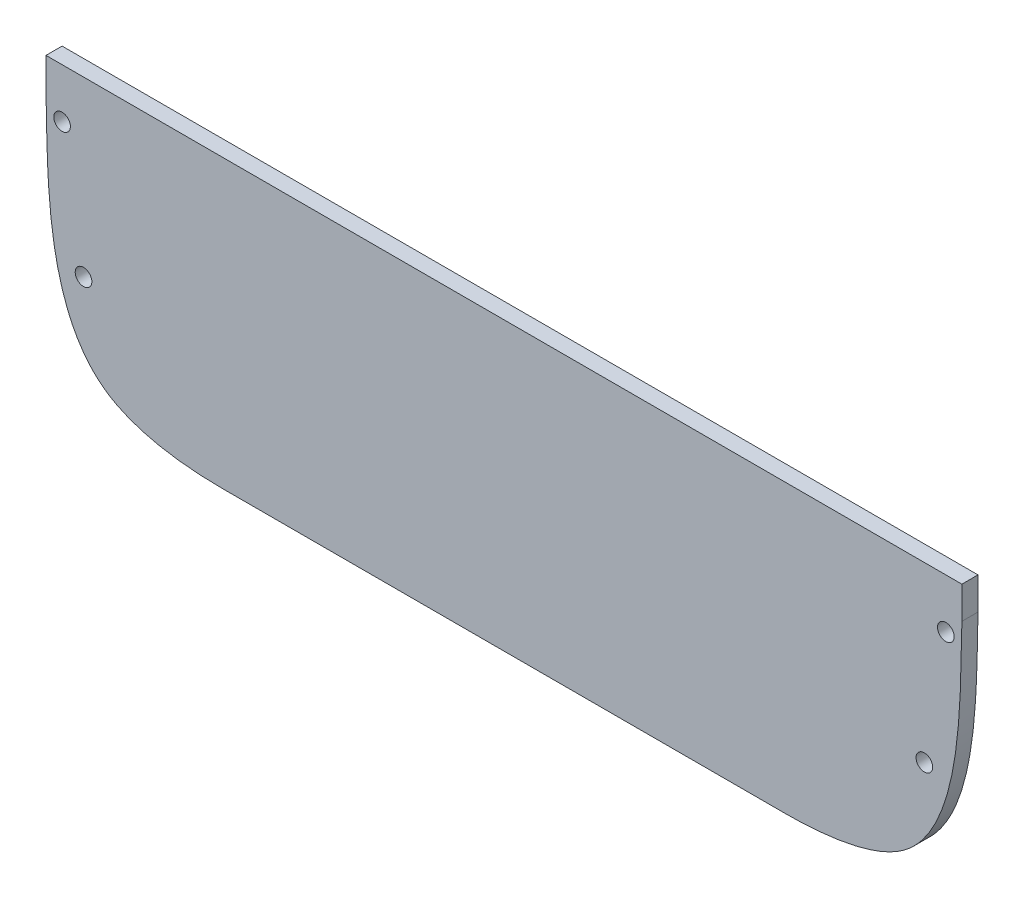
from build123d import *

# Parameters (mm, degrees)
SKETCH2_R           = 3.1
BOSS_EXTRUDE2_DEPTH = 6


with BuildPart() as part:
    # Sketch2 → Boss-Extrude2 (new body)
    with BuildSketch(Plane.XY):
        with BuildLine():
            Line((100, -56), (-105, -56))
            add(Edge.make_bspline(
                [(-170.77007734, 39.000109259), (-170.755319597, 38.457683604), (-170.706798384, 36.537887441), (-170.637287988, 33.122957729), (-170.5261489, 27.184054493), (-170.34340093, 19.366986891), (-169.889474506, 9.608710222), (-169.039164203, -0.266842999), (-167.1706255, -13.234272429), (-163.891886546, -25.351425111), (-158.719183516, -35.536226847), (-153.788973421, -41.996369681), (-147.740986476, -47.090640281), (-140.115988759, -50.864892697), (-131.329474875, -53.495779888), (-123.622789186, -54.830760959), (-117.546310091, -55.488589317), (-113.112089799, -55.803916745), (-109.593584136, -55.942092458), (-106.905885897, -55.99243235), (-105.641968688, -55.999999365), (-105, -56)],
                knots=[0.050003059, 0.050003059, 0.050003059, 0.050003059, 0.0625, 0.09375, 0.125, 0.1875, 0.25, 0.3125, 0.375, 0.5, 0.5625, 0.625, 0.6875, 0.75, 0.8125, 0.875, 0.90625, 0.9375, 0.96875, 0.984375, 1, 1, 1, 1], degree=3))
            Line((-170.77007734, 39.000109259), (-170.770080313, 51))
            Line((-170.770080313, 51), (159.005500018, 51))
            Line((159.005500018, 51), (170.770080313, 51))
            Line((170.770080313, 51), (170.770074367, 39.000109259))
            add(Edge.make_bspline(
                [(105, -56), (105.641968688, -55.999999365), (106.905885897, -55.99243235), (109.593584136, -55.942092457), (113.112089799, -55.803916745), (117.546310092, -55.488589317), (123.622789186, -54.830760959), (131.329474876, -53.495779888), (140.11598876, -50.864892696), (147.740986477, -47.09064028), (153.788973422, -41.996369679), (158.719183518, -35.536226846), (163.891886547, -25.351425109), (167.170625501, -13.234272427), (169.039164203, -0.266842997), (169.889474507, 9.608710225), (170.343400931, 19.366986894), (170.5261489, 27.184054497), (170.637287988, 33.122957733), (170.706798384, 36.537887444), (170.755319597, 38.457683605), (170.770074367, 39.000109259)],
                knots=[0, 0, 0, 0, 0.015625, 0.03125, 0.0625, 0.09375, 0.125, 0.1875, 0.25, 0.3125, 0.375, 0.4375, 0.5, 0.625, 0.6875, 0.75, 0.8125, 0.875, 0.90625, 0.9375, 0.949996941, 0.949996941, 0.949996941, 0.949996941], degree=3))
            Line((105, -56), (100, -56))
        make_face()
        with Locations((164.770080313, 32.55449126)):
            Circle(SKETCH2_R, mode=Mode.SUBTRACT)
        with Locations((-156.770064318, -13.565854924)):
            Circle(SKETCH2_R, mode=Mode.SUBTRACT)
        with Locations((-164.770080313, 32.55449126)):
            Circle(SKETCH2_R, mode=Mode.SUBTRACT)
        with Locations((156.770064318, -13.565854924)):
            Circle(SKETCH2_R, mode=Mode.SUBTRACT)
    extrude(amount=BOSS_EXTRUDE2_DEPTH)


solid = part.part
